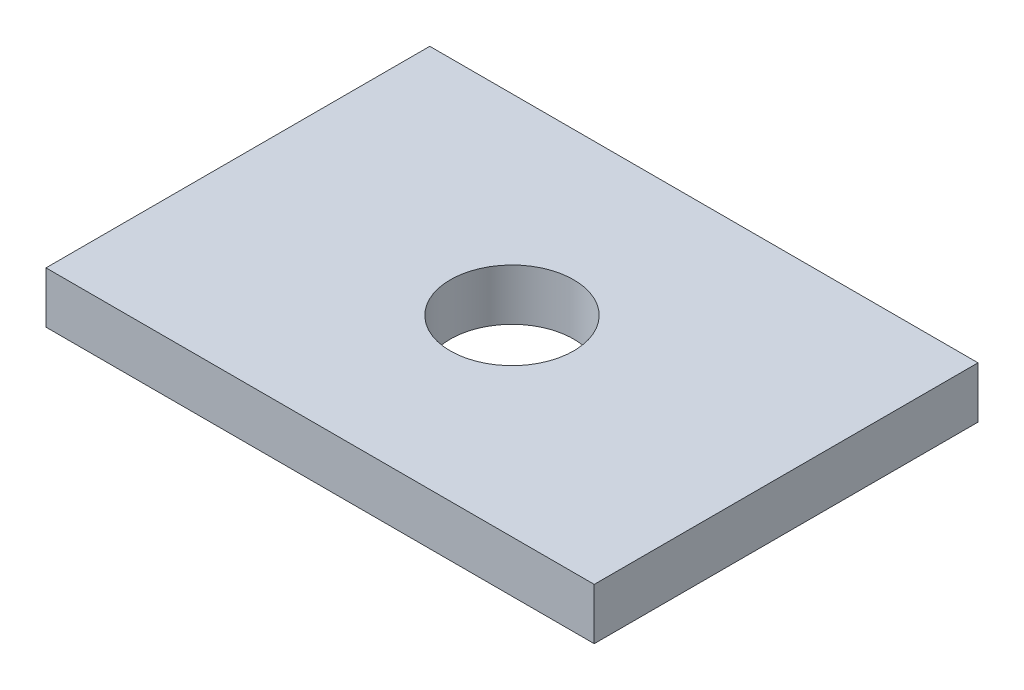
from build123d import *

# Parameters (mm, degrees)
SKETCH1_W           = 127
SKETCH1_H           = 88.9
SKETCH1_R           = 14.2875
BOSS_EXTRUDE1_DEPTH = 11.90625


with BuildPart() as part:
    # Sketch1 → Boss-Extrude1 (new body)
    with BuildSketch(Plane(origin=(0, 0, 0), x_dir=(1, 0, 0), z_dir=(0, 1, 0))):
        with Locations((63.5, 44.45)):
            Rectangle(SKETCH1_W, SKETCH1_H)
        with Locations(Location((63.5, 44.45, 0), (0, 0, 270))):
            Circle(SKETCH1_R, mode=Mode.SUBTRACT)
    extrude(amount=BOSS_EXTRUDE1_DEPTH)


solid = part.part
